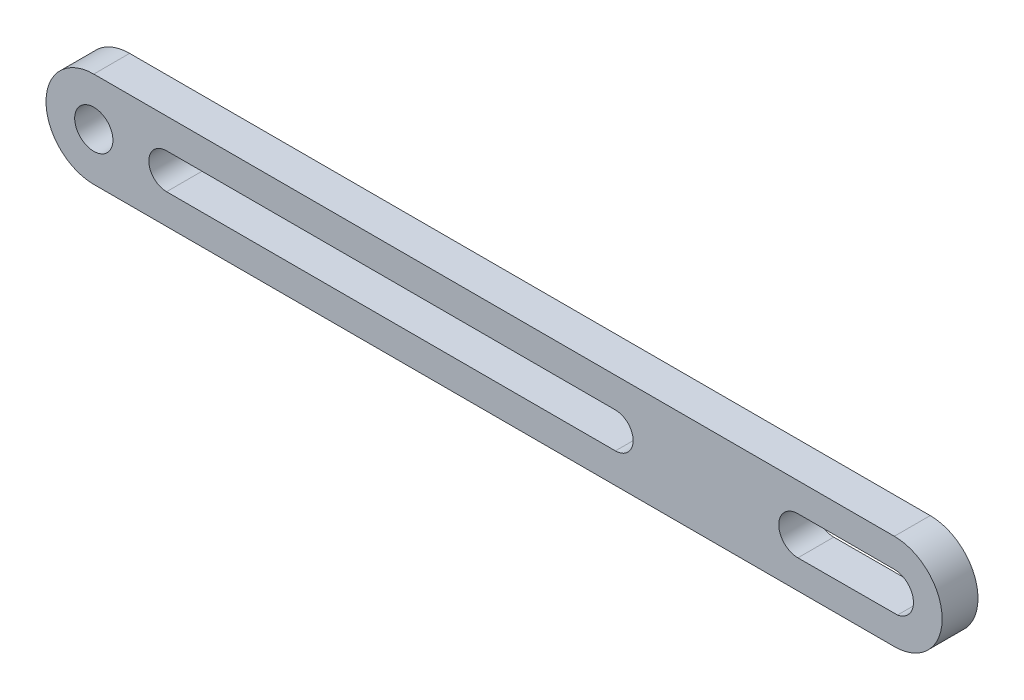
from build123d import *

# Parameters (mm, degrees)
EXTRUDE_1_DEPTH     = 3
SKETCH_7_R          = 1.6
CUT_EXTRUDE_1_DEPTH = 3


with BuildPart() as part:
    # 草图1 → 凸台-拉伸1 (new body)
    with BuildSketch(Plane.XY):
        with BuildLine():
            Line((-53.850242828, 4), (13.149757172, 4))
            ThreePointArc((13.149757172, 4), (17.149757172, 0), (13.149757172, -4))
            Line((13.149757172, -4), (-53.850242828, -4))
            ThreePointArc((-53.850242828, -4), (-57.850242828, 0), (-53.850242828, 4))
        make_face()
    extrude(amount=EXTRUDE_1_DEPTH)

    # 草图7 → 切除-拉伸1 (cut)
    with BuildSketch(Plane.XY.offset(3)):
        with Locations((-53.850242828, 0)):
            Circle(SKETCH_7_R)
        with BuildLine():
            Line((-47.761926325, 1.483471582), (-10.194558278, 1.483471582))
            ThreePointArc((-10.194558278, 1.483471582), (-8.711086696, 0), (-10.194558278, -1.483471582))
            Line((-10.194558278, -1.483471582), (-47.761926325, -1.483471582))
            ThreePointArc((-47.761926325, -1.483471582), (-49.245397907, 0), (-47.761926325, 1.483471582))
        make_face()
        with BuildLine():
            Line((5.076512497, 1.6), (13.149757172, 1.6))
            ThreePointArc((13.149757172, 1.6), (14.744323235, 0.131753831), (13.412369906, -1.57830116))
            Line((13.412369906, -1.57830116), (5.076512497, -1.6))
            ThreePointArc((5.076512497, -1.6), (3.476512497, 0), (5.076512497, 1.6))
        make_face()
    extrude(amount=-CUT_EXTRUDE_1_DEPTH, mode=Mode.SUBTRACT)


solid = part.part
